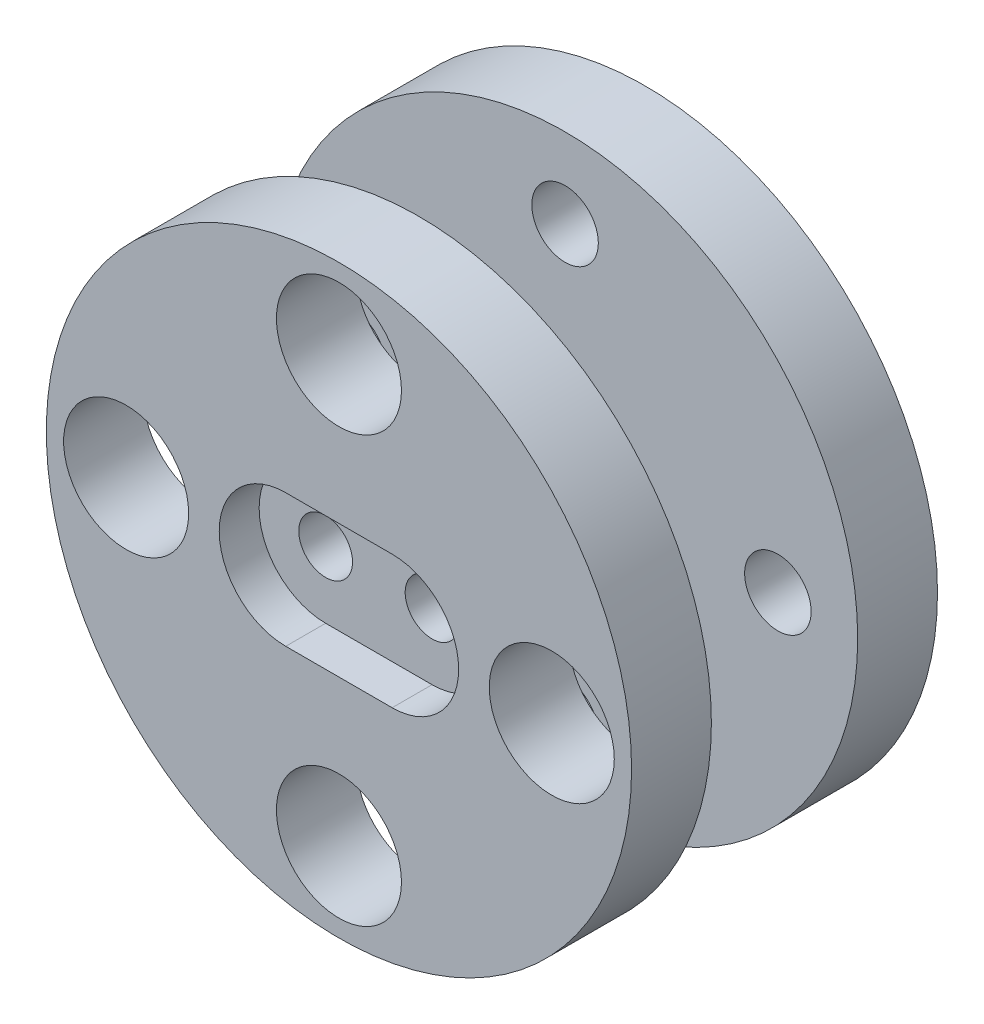
from build123d import *

# Parameters (mm, degrees)
SKETCH_1_R          = 11
SKETCH_1_R_2        = 1.25
EXTRUDE_1_DEPTH     = 3
SKETCH_2_R          = 3
EXTRUDE_2_DEPTH     = 5.5
SKETCH_3_R          = 11
SKETCH_3_R_2        = 2.35
EXTRUDE_3_DEPTH     = 3
CUT_EXTRUDE_START   = -11.5
SKETCH_8_R          = 1.01
CUT_EXTRUDE_4_DEPTH = 11.5
SKETCH_9_R          = 0.8
CUT_EXTRUDE_5_DEPTH = 3
CUT_EXTRUDE_6_DEPTH = 1.5


with BuildPart() as part:
    # ｽｹｯﾁ1 → ﾎﾞｽ - 押し出し1 (new body)
    with BuildSketch(Plane.XY):
        Circle(SKETCH_1_R)
        with Locations((-8, 0)):
            Circle(SKETCH_1_R_2, mode=Mode.SUBTRACT)
        with Locations((0, 8)):
            Circle(SKETCH_1_R_2, mode=Mode.SUBTRACT)
        with Locations((8, 0)):
            Circle(SKETCH_1_R_2, mode=Mode.SUBTRACT)
        with Locations((0, -8)):
            Circle(SKETCH_1_R_2, mode=Mode.SUBTRACT)
    extrude(amount=EXTRUDE_1_DEPTH)

    # ｽｹｯﾁ9 → ｶｯﾄ - 押し出し5 (cut)
    with BuildSketch(Plane.XY.offset(3)):
        with Locations((-2, 0)):
            Circle(SKETCH_9_R)
        with Locations((2, 0)):
            Circle(SKETCH_9_R)
    extrude(amount=-CUT_EXTRUDE_5_DEPTH, mode=Mode.SUBTRACT)


with BuildPart() as body_2:
    # ｽｹｯﾁ2 → ﾎﾞｽ - 押し出し2 (new body)
    with BuildSketch(Plane.XY.offset(3)):
        Circle(SKETCH_2_R)
    extrude(amount=EXTRUDE_2_DEPTH)


with BuildPart() as body_3:
    # ｽｹｯﾁ3 → ﾎﾞｽ - 押し出し3 (new body)
    with BuildSketch(Plane.XY.offset(8.5)):
        Circle(SKETCH_3_R)
        with Locations((-8, 0)):
            Circle(SKETCH_3_R_2, mode=Mode.SUBTRACT)
        with Locations((0, 8)):
            Circle(SKETCH_3_R_2, mode=Mode.SUBTRACT)
        with Locations((8, 0)):
            Circle(SKETCH_3_R_2, mode=Mode.SUBTRACT)
        with Locations((0, -8)):
            Circle(SKETCH_3_R_2, mode=Mode.SUBTRACT)
    extrude(amount=EXTRUDE_3_DEPTH)


with BuildPart() as cut_extrude_4_tool:
    # ｽｹｯﾁ8 → ｶｯﾄ - 押し出し4 (new body)
    with BuildSketch(Plane.XY.offset(11.5).offset(CUT_EXTRUDE_START)):
        with Locations((-2, 0)):
            Circle(SKETCH_8_R)
        with Locations((2, 0)):
            Circle(SKETCH_8_R)
    extrude(amount=CUT_EXTRUDE_4_DEPTH)


with BuildPart() as body_2_1:
    add(body_2.part)

    # ｶｯﾄ - 押し出し4: cut by cut_extrude_4_tool
    add(cut_extrude_4_tool.part, mode=Mode.SUBTRACT)


with BuildPart() as body_3_1:
    add(body_3.part)

    # ｶｯﾄ - 押し出し4: cut by cut_extrude_4_tool
    add(cut_extrude_4_tool.part, mode=Mode.SUBTRACT)

    # ｽｹｯﾁ11 → ｶｯﾄ - 押し出し6 (cut)
    with BuildSketch(Plane.XY.offset(11.5)):
        with BuildLine():
            Line((-2, 2.5), (2, 2.5))
            ThreePointArc((2, 2.5), (4.5, 0), (2, -2.5))
            Line((2, -2.5), (-2, -2.5))
            ThreePointArc((-2, -2.5), (-4.5, 0), (-2, 2.5))
        make_face()
    extrude(amount=-CUT_EXTRUDE_6_DEPTH, mode=Mode.SUBTRACT)


solid = Compound([part.part, body_2_1.part, body_3_1.part])
